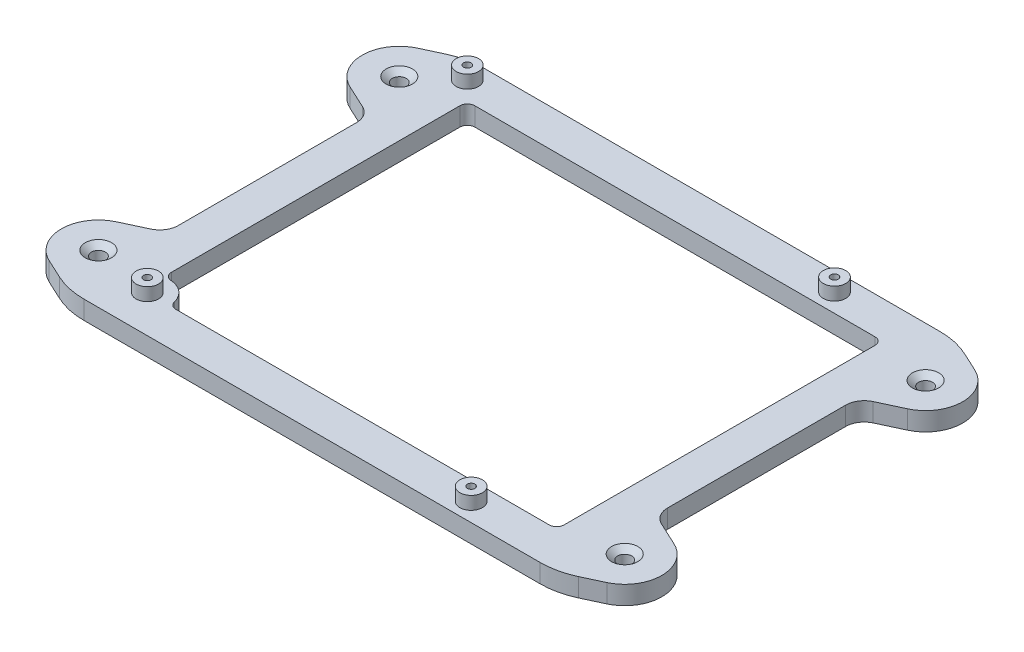
from build123d import *

# Parameters (mm, degrees)
QUARTER_BASE_DEPTH                 = 5
CORNER_SCREW_EXPANSION_SKETCH_R    = 6.025
CORNER_SCREW_EXPANSION_DEPTH       = 5
STANDOFFS_EXTRUSION_SKETCH_R       = 3.025
STANDOFFS_EXTRUSION_DEPTH          = 3.5
SMOOTHIEBOARD_SCREW_HOLES_SKETCH_R = 1.025
SMOOTHIEBOARD_SCREW_HOLES_DEPTH    = 98.695404319
NO_6_MOUNTING_SCREWS_D             = 3.7973
NO_6_MOUNTING_SCREWS_CSINK_D       = 7.0866
NO_6_MOUNTING_SCREWS_CSINK_ANGLE   = 100
INSIDE_CORNER_FILLETS_R            = 2
OUTSIDE_CORNER_FILLETS_1_R         = 5
OUTSIDE_CORNER_FILLETS_2_R         = 20


with BuildPart() as part:
    # Quarter Base Sketch → Quarter Base (new body)
    with BuildSketch(Plane(origin=(0, 0, 0), x_dir=(1, 0, 0), z_dir=(0, 1, 0))):
        with BuildLine():
            Line((0, 53.955), (-66, 53.955))
            Line((-66, 53.955), (-75.226182617, 49.65276039))
            ThreePointArc((-75.226182617, 49.65276039), (-81, 40.58968252), (-75.226182617, 31.526604649))
            Line((-75.226182617, 31.526604649), (-66, 27.224365039))
            Line((-66, 27.224365039), (-66, 0))
            Line((-66, 0), (-56, 0))
            Line((-56, 0), (-56, 43.955))
            Line((-56, 43.955), (0, 43.955))
            Line((0, 43.955), (0, 53.955))
        make_face()
    extrude(amount=QUARTER_BASE_DEPTH)

    # Base Mirror 1: part across plane


with BuildPart() as part_1:
    add(part.part)
    add(part.part.mirror(Plane(origin=(-66, 5, 0), x_dir=(1, 0, 0), z_dir=(0, 0, -1))))

    # Base Mirror 2: part across plane


with BuildPart() as part_2:
    add(part_1.part)
    add(part_1.part.mirror(Plane(origin=(0, 5, -43.955), x_dir=(0, 0, 1), z_dir=(-1, 0, 0))))

    # Corner Screw Expansion Sketch → Corner Screw Expansion (add)
    with BuildSketch(Plane(origin=(0, 5, 0), x_dir=(1, 0, 0), z_dir=(0, 1, 0))):
        with Locations((-54.523, -43.876)):
            Circle(CORNER_SCREW_EXPANSION_SKETCH_R)
    extrude(amount=-CORNER_SCREW_EXPANSION_DEPTH)

    # Standoffs Extrusion Sketch → Standoffs Extrusion (add)
    with BuildSketch(Plane(origin=(0, 5, 0), x_dir=(1, 0, 0), z_dir=(0, 1, 0))):
        with Locations(Location((-61, 48.955, 0), (0, 0, 270))):
            Circle(STANDOFFS_EXTRUSION_SKETCH_R)
        with Locations(Location((-54.523, -43.876, 0), (0, 0, 270))):
            Circle(STANDOFFS_EXTRUSION_SKETCH_R)
        with Locations(Location((37.933, -48.955, 0), (0, 0, 270))):
            Circle(STANDOFFS_EXTRUSION_SKETCH_R)
        with Locations(Location((38.06, 48.955, 0), (0, 0, 270))):
            Circle(STANDOFFS_EXTRUSION_SKETCH_R)
    extrude(amount=STANDOFFS_EXTRUSION_DEPTH)

    # Smoothieboard Screw Holes Sketch → Smoothieboard Screw Holes (cut, through all)
    with BuildSketch(Plane(origin=(0, 8.5, 0), x_dir=(1, 0, 0), z_dir=(0, 1, 0))):
        with Locations(Location((-54.523, -43.876, 0), (0, 0, 270))):
            Circle(SMOOTHIEBOARD_SCREW_HOLES_SKETCH_R)
        with Locations(Location((37.933, -48.955, 0), (0, 0, 270))):
            Circle(SMOOTHIEBOARD_SCREW_HOLES_SKETCH_R)
        with Locations(Location((38.06, 48.955, 0), (0, 0, 270))):
            Circle(SMOOTHIEBOARD_SCREW_HOLES_SKETCH_R)
        with Locations(Location((-61, 48.955, 0), (0, 0, 270))):
            Circle(SMOOTHIEBOARD_SCREW_HOLES_SKETCH_R)
    extrude(amount=-SMOOTHIEBOARD_SCREW_HOLES_DEPTH, mode=Mode.SUBTRACT)

    # No. 6 Mounting Screws (through all)
    with Locations(Plane(origin=(-71, 5, -40.58968252), x_dir=(0, 0, 1), z_dir=(0, 1, 0))):
        with Locations((0, 0), (81.17936504, 0), (81.17936504, 142), (0, 142)):
            CounterSinkHole(NO_6_MOUNTING_SCREWS_D / 2, NO_6_MOUNTING_SCREWS_CSINK_D / 2, counter_sink_angle=NO_6_MOUNTING_SCREWS_CSINK_ANGLE)

    # Inside Corner Fillets
    inside_corner_fillets_edges = [part_2.edges().sort_by_distance(p)[0] for p in [
        (-56, 2.5, -43.955),
        (56, 2.5, -43.955),
        (56, 2.5, 43.955),
        (-48.498517948, 2.5, 43.955),
        (-56, 2.5, 38.034844635),
    ]]
    fillet(inside_corner_fillets_edges, radius=INSIDE_CORNER_FILLETS_R)

    # Outside Corner Fillets 1
    outside_corner_fillets_1_edges = [part_2.edges().sort_by_distance(p)[0] for p in [
        (-66, 2.5, -27.224365039),
        (-66, 2.5, 27.224365039),
        (66, 2.5, -27.224365039),
        (66, 2.5, 27.224365039),
    ]]
    fillet(outside_corner_fillets_1_edges, radius=OUTSIDE_CORNER_FILLETS_1_R)

    # Outside Corner Fillets 2
    outside_corner_fillets_2_edges = [part_2.edges().sort_by_distance(p)[0] for p in [
        (-66, 2.5, -53.955),
        (-66, 2.5, 53.955),
        (66, 2.5, -53.955),
        (66, 2.5, 53.955),
    ]]
    fillet(outside_corner_fillets_2_edges, radius=OUTSIDE_CORNER_FILLETS_2_R)


solid = part_2.part
